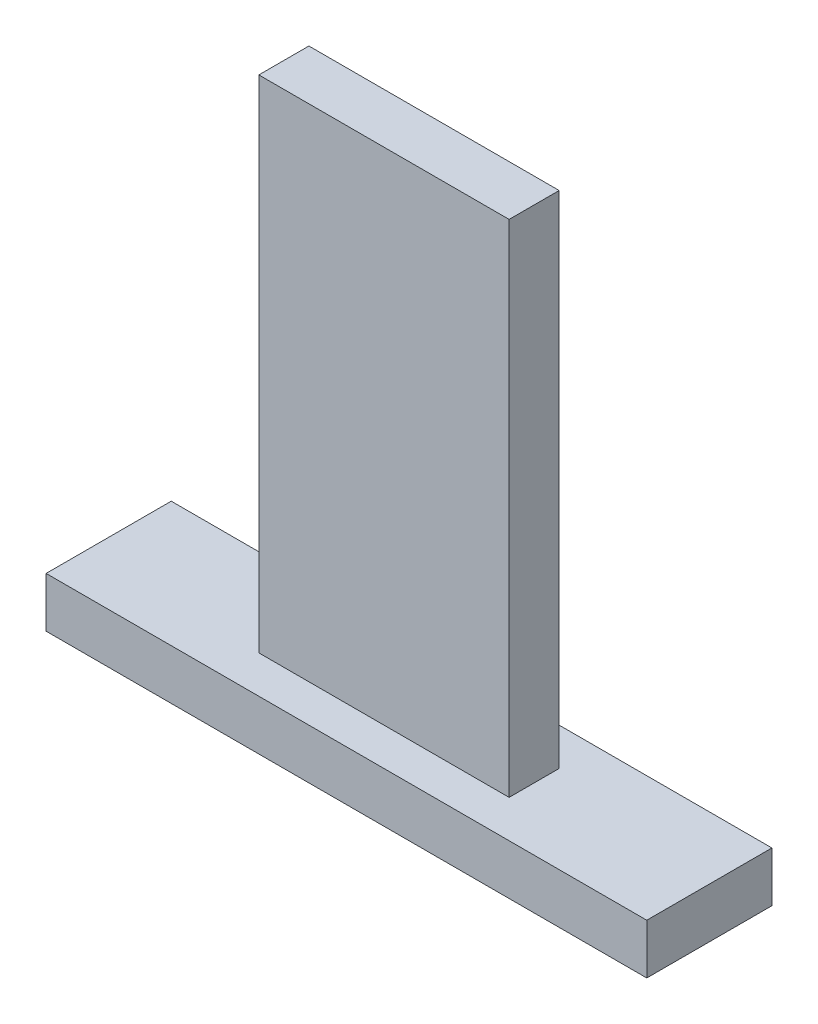
from build123d import *

# Parameters (mm, degrees)
SKETCH_1_W      = 1000
SKETCH_1_H      = 2000
EXTRUDE_1_DEPTH = 200
SKETCH_2_W      = 2400
SKETCH_2_H      = 500
EXTRUDE_2_DEPTH = 200


with BuildPart() as part:
    # 草图1 → 凸台-拉伸1 (new body)
    with BuildSketch(Plane.XY):
        Rectangle(SKETCH_1_W, SKETCH_1_H)
    extrude(amount=EXTRUDE_1_DEPTH)

    # 草图2 → 凸台-拉伸2 (add)
    with BuildSketch(Plane.XZ.offset(1000)):
        with Locations((0, 100)):
            Rectangle(SKETCH_2_W, SKETCH_2_H)
    extrude(amount=EXTRUDE_2_DEPTH)


solid = part.part
